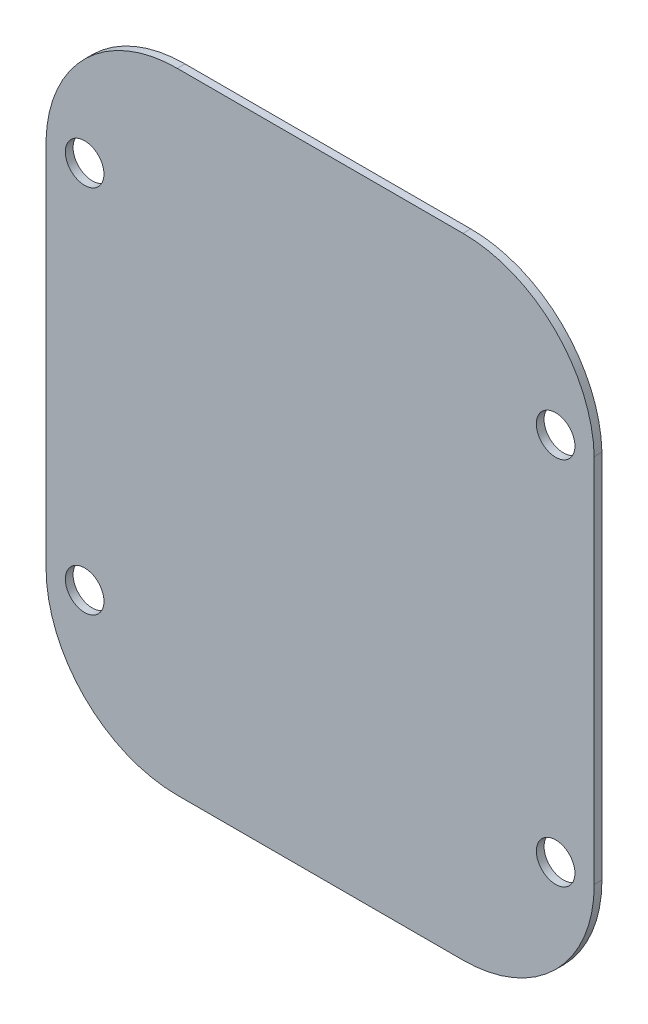
from build123d import *

# Parameters (mm, degrees)
BOSS_EXTRUDE1_DEPTH = 5
SKETCH2_R           = 12.5
CUT_EXTRUDE1_DEPTH  = 5


with BuildPart() as part:
    # Sketch1 → Boss-Extrude1 (new body)
    with BuildSketch(Plane.XY):
        with BuildLine():
            Line((92.561405604, 203.898469388), (-92.561405604, 203.898469388))
            ThreePointArc((-92.561405604, 203.898469388), (-151.899798681, 179.786429097), (-177.561405604, 121.101530612))
            Line((-177.561405604, 121.101530612), (-177.561405604, -118.898469388))
            ThreePointArc((-177.561405604, -118.898469388), (-152.665482005, -179.002545789), (-92.561405604, -203.898469388))
            Line((-92.561405604, -203.898469388), (92.561405604, -203.898469388))
            ThreePointArc((92.561405604, -203.898469388), (152.665482005, -179.002545789), (177.561405604, -118.898469388))
            Line((177.561405604, -118.898469388), (177.561405604, 121.101530612))
            ThreePointArc((177.561405604, 121.101530612), (151.899798681, 179.786429097), (92.561405604, 203.898469388))
        make_face()
    extrude(amount=BOSS_EXTRUDE1_DEPTH)

    # Sketch2 → Cut-Extrude1 (cut)
    with BuildSketch(Plane.XY.offset(5)):
        with Locations((-152.561405604, 120.749347026)):
            Circle(SKETCH2_R)
        with Locations((-152.561405604, -118.898469388)):
            Circle(SKETCH2_R)
        with Locations((152.561405604, -118.898469388)):
            Circle(SKETCH2_R)
        with Locations((152.561405604, 120.749347026)):
            Circle(SKETCH2_R)
    extrude(amount=-CUT_EXTRUDE1_DEPTH, mode=Mode.SUBTRACT)


solid = part.part
